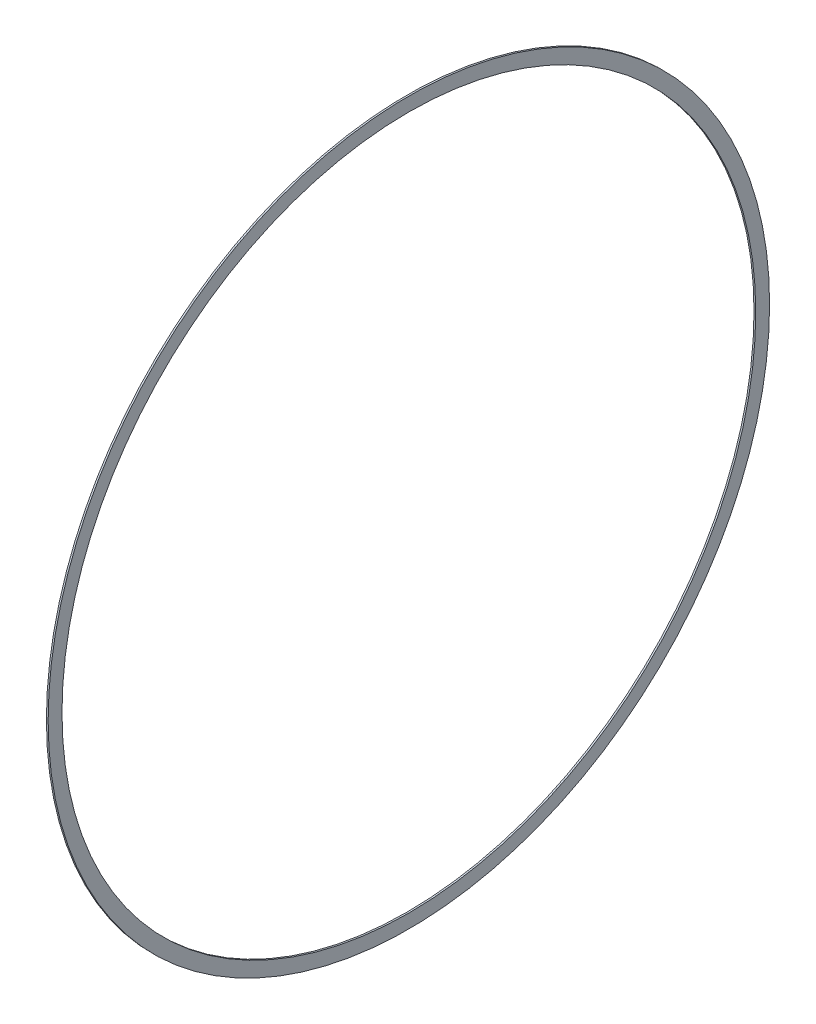
from build123d import *

# Parameters (mm, degrees)
SKETCH1_R           = 1042
SKETCH1_R_2         = 1002
BOSS_EXTRUDE1_DEPTH = 5


with BuildPart() as part:
    # Sketch1 → Boss-Extrude1 (new body)
    with BuildSketch(Plane(origin=(0, 0, 0), x_dir=(0, 0, -1), z_dir=(1, 0, 0))):
        Circle(SKETCH1_R)
        Circle(SKETCH1_R_2, mode=Mode.SUBTRACT)
    extrude(amount=BOSS_EXTRUDE1_DEPTH)


solid = part.part
